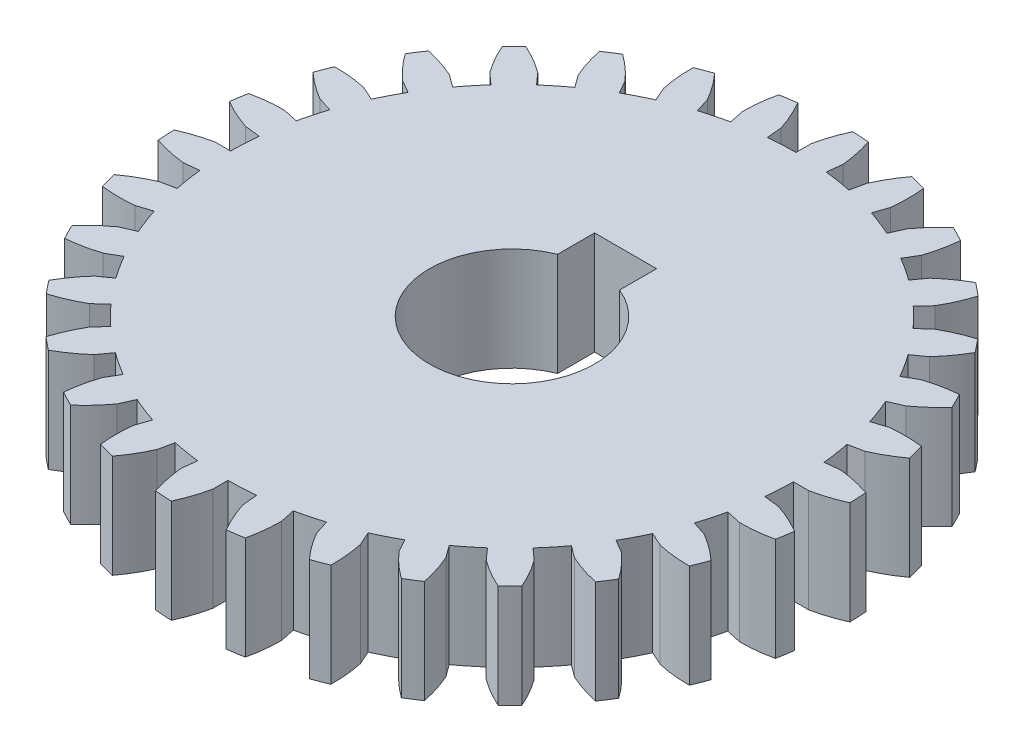
from build123d import *

# Parameters (mm, degrees)
BOSS_EXTRUDE1_DEPTH = 5
CIRPATTERN4_COUNT   = 30
SKETCH6_R           = 13.75
BOSS_EXTRUDE2_DEPTH = 5
SKETCH7_R           = 4
SKETCH7_W           = 3
SKETCH7_H           = 3
CUT_EXTRUDE1_DEPTH  = 24.164961557


with BuildPart() as part:
    # Sketch3 → Boss-Extrude1 (new body)
    with BuildSketch(Plane(origin=(0, 0, 0), x_dir=(1, 0, 0), z_dir=(0, 1, 0))):
        with BuildLine():
            Line((1.638753341, 14.395914192), (1.555182107, 13.661768136))
            ThreePointArc((1.555182107, 13.661768136), (0.778841487, 13.727924313), (0, 13.75))
            Line((0, 13.75), (0, 14.488887394))
            ThreePointArc((0, 14.488887394), (0.209356722, 15.254416091), (0.502024019, 15.992122182))
            ThreePointArc((0.502024019, 15.992122182), (0.906288276, 15.974311928), (1.309972839, 15.94628393))
            ThreePointArc((1.309972839, 15.94628393), (1.517324507, 15.180209711), (1.638753341, 14.395914192))
        make_face()
    extrude(amount=BOSS_EXTRUDE1_DEPTH)


with BuildPart() as cirpattern4_1:
    # CirPattern4: pattern copy
    add(part.part.rotate(Axis((0, 0, 0), (0, 1, 0)), 1 * 360 / CIRPATTERN4_COUNT))


with BuildPart() as cirpattern4_2:
    # CirPattern4: pattern copy
    add(part.part.rotate(Axis((0, 0, 0), (0, 1, 0)), 2 * 360 / CIRPATTERN4_COUNT))


with BuildPart() as cirpattern4_3:
    # CirPattern4: pattern copy
    add(part.part.rotate(Axis((0, 0, 0), (0, 1, 0)), 3 * 360 / CIRPATTERN4_COUNT))


with BuildPart() as cirpattern4_4:
    # CirPattern4: pattern copy
    add(part.part.rotate(Axis((0, 0, 0), (0, 1, 0)), 4 * 360 / CIRPATTERN4_COUNT))


with BuildPart() as cirpattern4_5:
    # CirPattern4: pattern copy
    add(part.part.rotate(Axis((0, 0, 0), (0, 1, 0)), 5 * 360 / CIRPATTERN4_COUNT))


with BuildPart() as cirpattern4_6:
    # CirPattern4: pattern copy
    add(part.part.rotate(Axis((0, 0, 0), (0, 1, 0)), 6 * 360 / CIRPATTERN4_COUNT))


with BuildPart() as cirpattern4_7:
    # CirPattern4: pattern copy
    add(part.part.rotate(Axis((0, 0, 0), (0, 1, 0)), 7 * 360 / CIRPATTERN4_COUNT))


with BuildPart() as cirpattern4_8:
    # CirPattern4: pattern copy
    add(part.part.rotate(Axis((0, 0, 0), (0, 1, 0)), 8 * 360 / CIRPATTERN4_COUNT))


with BuildPart() as cirpattern4_9:
    # CirPattern4: pattern copy
    add(part.part.rotate(Axis((0, 0, 0), (0, 1, 0)), 9 * 360 / CIRPATTERN4_COUNT))


with BuildPart() as cirpattern4_10:
    # CirPattern4: pattern copy
    add(part.part.rotate(Axis((0, 0, 0), (0, 1, 0)), 10 * 360 / CIRPATTERN4_COUNT))


with BuildPart() as cirpattern4_11:
    # CirPattern4: pattern copy
    add(part.part.rotate(Axis((0, 0, 0), (0, 1, 0)), 11 * 360 / CIRPATTERN4_COUNT))


with BuildPart() as cirpattern4_12:
    # CirPattern4: pattern copy
    add(part.part.rotate(Axis((0, 0, 0), (0, 1, 0)), 12 * 360 / CIRPATTERN4_COUNT))


with BuildPart() as cirpattern4_13:
    # CirPattern4: pattern copy
    add(part.part.rotate(Axis((0, 0, 0), (0, 1, 0)), 13 * 360 / CIRPATTERN4_COUNT))


with BuildPart() as cirpattern4_14:
    # CirPattern4: pattern copy
    add(part.part.rotate(Axis((0, 0, 0), (0, 1, 0)), 14 * 360 / CIRPATTERN4_COUNT))


with BuildPart() as cirpattern4_15:
    # CirPattern4: pattern copy
    add(part.part.rotate(Axis((0, 0, 0), (0, 1, 0)), 15 * 360 / CIRPATTERN4_COUNT))


with BuildPart() as cirpattern4_16:
    # CirPattern4: pattern copy
    add(part.part.rotate(Axis((0, 0, 0), (0, 1, 0)), 16 * 360 / CIRPATTERN4_COUNT))


with BuildPart() as cirpattern4_17:
    # CirPattern4: pattern copy
    add(part.part.rotate(Axis((0, 0, 0), (0, 1, 0)), 17 * 360 / CIRPATTERN4_COUNT))


with BuildPart() as cirpattern4_18:
    # CirPattern4: pattern copy
    add(part.part.rotate(Axis((0, 0, 0), (0, 1, 0)), 18 * 360 / CIRPATTERN4_COUNT))


with BuildPart() as cirpattern4_19:
    # CirPattern4: pattern copy
    add(part.part.rotate(Axis((0, 0, 0), (0, 1, 0)), 19 * 360 / CIRPATTERN4_COUNT))


with BuildPart() as cirpattern4_20:
    # CirPattern4: pattern copy
    add(part.part.rotate(Axis((0, 0, 0), (0, 1, 0)), 20 * 360 / CIRPATTERN4_COUNT))


with BuildPart() as cirpattern4_21:
    # CirPattern4: pattern copy
    add(part.part.rotate(Axis((0, 0, 0), (0, 1, 0)), 21 * 360 / CIRPATTERN4_COUNT))


with BuildPart() as cirpattern4_22:
    # CirPattern4: pattern copy
    add(part.part.rotate(Axis((0, 0, 0), (0, 1, 0)), 22 * 360 / CIRPATTERN4_COUNT))


with BuildPart() as cirpattern4_23:
    # CirPattern4: pattern copy
    add(part.part.rotate(Axis((0, 0, 0), (0, 1, 0)), 23 * 360 / CIRPATTERN4_COUNT))


with BuildPart() as cirpattern4_24:
    # CirPattern4: pattern copy
    add(part.part.rotate(Axis((0, 0, 0), (0, 1, 0)), 24 * 360 / CIRPATTERN4_COUNT))


with BuildPart() as cirpattern4_25:
    # CirPattern4: pattern copy
    add(part.part.rotate(Axis((0, 0, 0), (0, 1, 0)), 25 * 360 / CIRPATTERN4_COUNT))


with BuildPart() as cirpattern4_26:
    # CirPattern4: pattern copy
    add(part.part.rotate(Axis((0, 0, 0), (0, 1, 0)), 26 * 360 / CIRPATTERN4_COUNT))


with BuildPart() as cirpattern4_27:
    # CirPattern4: pattern copy
    add(part.part.rotate(Axis((0, 0, 0), (0, 1, 0)), 27 * 360 / CIRPATTERN4_COUNT))


with BuildPart() as cirpattern4_28:
    # CirPattern4: pattern copy
    add(part.part.rotate(Axis((0, 0, 0), (0, 1, 0)), 28 * 360 / CIRPATTERN4_COUNT))


with BuildPart() as cirpattern4_29:
    # CirPattern4: pattern copy
    add(part.part.rotate(Axis((0, 0, 0), (0, 1, 0)), 29 * 360 / CIRPATTERN4_COUNT))


with BuildPart() as part_1:
    add(part.part)

    add(cirpattern4_1.part)  # Boss-Extrude2 merges CirPattern4_1

    add(cirpattern4_2.part)  # Boss-Extrude2 merges CirPattern4_2

    add(cirpattern4_3.part)  # Boss-Extrude2 merges CirPattern4_3

    add(cirpattern4_4.part)  # Boss-Extrude2 merges CirPattern4_4

    add(cirpattern4_5.part)  # Boss-Extrude2 merges CirPattern4_5

    add(cirpattern4_6.part)  # Boss-Extrude2 merges CirPattern4_6

    add(cirpattern4_7.part)  # Boss-Extrude2 merges CirPattern4_7

    add(cirpattern4_8.part)  # Boss-Extrude2 merges CirPattern4_8

    add(cirpattern4_9.part)  # Boss-Extrude2 merges CirPattern4_9

    add(cirpattern4_10.part)  # Boss-Extrude2 merges CirPattern4_10

    add(cirpattern4_11.part)  # Boss-Extrude2 merges CirPattern4_11

    add(cirpattern4_12.part)  # Boss-Extrude2 merges CirPattern4_12

    add(cirpattern4_13.part)  # Boss-Extrude2 merges CirPattern4_13

    add(cirpattern4_14.part)  # Boss-Extrude2 merges CirPattern4_14

    add(cirpattern4_15.part)  # Boss-Extrude2 merges CirPattern4_15

    add(cirpattern4_16.part)  # Boss-Extrude2 merges CirPattern4_16

    add(cirpattern4_17.part)  # Boss-Extrude2 merges CirPattern4_17

    add(cirpattern4_18.part)  # Boss-Extrude2 merges CirPattern4_18

    add(cirpattern4_19.part)  # Boss-Extrude2 merges CirPattern4_19

    add(cirpattern4_20.part)  # Boss-Extrude2 merges CirPattern4_20

    add(cirpattern4_21.part)  # Boss-Extrude2 merges CirPattern4_21

    add(cirpattern4_22.part)  # Boss-Extrude2 merges CirPattern4_22

    add(cirpattern4_23.part)  # Boss-Extrude2 merges CirPattern4_23

    add(cirpattern4_24.part)  # Boss-Extrude2 merges CirPattern4_24

    add(cirpattern4_25.part)  # Boss-Extrude2 merges CirPattern4_25

    add(cirpattern4_26.part)  # Boss-Extrude2 merges CirPattern4_26

    add(cirpattern4_27.part)  # Boss-Extrude2 merges CirPattern4_27

    add(cirpattern4_28.part)  # Boss-Extrude2 merges CirPattern4_28

    add(cirpattern4_29.part)  # Boss-Extrude2 merges CirPattern4_29
    # Sketch6 → Boss-Extrude2 (add)
    with BuildSketch(Plane(origin=(0, 0, 0), x_dir=(1, 0, 0), z_dir=(0, 1, 0))):
        Circle(SKETCH6_R)
    extrude(amount=BOSS_EXTRUDE2_DEPTH)

    # Sketch7 → Cut-Extrude1 (cut, through all)
    with BuildSketch(Plane(origin=(0, 5, 0), x_dir=(1, 0, 0), z_dir=(0, 1, 0))):
        Circle(SKETCH7_R)
        with Locations((0, 4)):
            Rectangle(SKETCH7_W, SKETCH7_H)
    extrude(amount=-CUT_EXTRUDE1_DEPTH, mode=Mode.SUBTRACT)


solid = part_1.part
